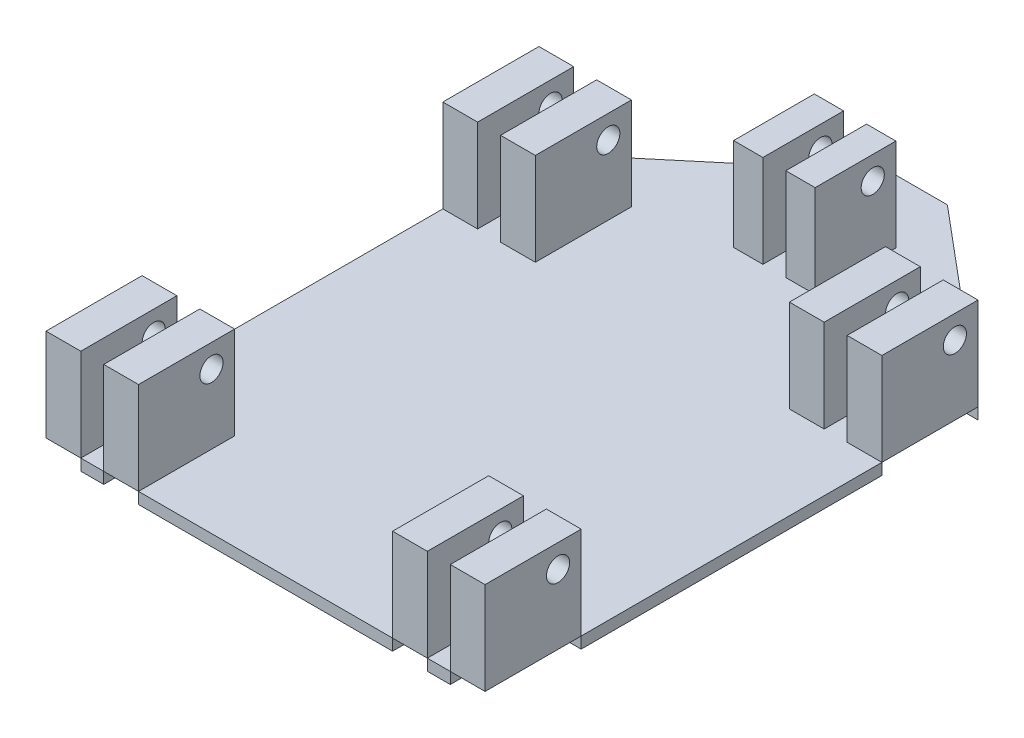
from build123d import *

# Parameters (mm, degrees)
SKETCH3_W              = 12.673843353
SKETCH3_H              = 34.882924186
BOSS_EXTRUDE1_DEPTH    = 40
SKETCH3_W_2            = 15.035841509
SKETCH3_H_2            = 41.527562264
BOSS_EXTRUDE1_2_DEPTH  = 40
SKETCH3_W_3            = 15.03584151
BOSS_EXTRUDE1_3_DEPTH  = 40
BOSS_EXTRUDE1_4_DEPTH  = 40
BOSS_EXTRUDE1_5_DEPTH  = 40
BOSS_EXTRUDE1_6_DEPTH  = 40
BOSS_EXTRUDE1_7_DEPTH  = 40
BOSS_EXTRUDE1_8_DEPTH  = 40
BOSS_EXTRUDE1_9_DEPTH  = 40
BOSS_EXTRUDE1_10_DEPTH = 40
BOSS_EXTRUDE3_DEPTH    = 4.92
CUT_EXTRUDE1_START     = -189.738
SKETCH6_R              = 5
CUT_EXTRUDE1_DEPTH     = 189.738
SKETCH5_R              = 5
CUT_EXTRUDE2_DEPTH     = 203.294
SKETCH4_R              = 5
CUT_EXTRUDE3_DEPTH     = 203.294


with BuildPart() as part:
    # Sketch3 → Boss-Extrude1 (new body)
    with BuildSketch(Plane(origin=(0, 0, 0), x_dir=(1, 0, 0), z_dir=(0, 1, 0))):
        with Locations((-11.289921677, 130.817819602)):
            Rectangle(SKETCH3_W, SKETCH3_H)
    extrude(amount=BOSS_EXTRUDE1_DEPTH)


with BuildPart() as body_2:
    # Sketch3 → Boss-Extrude1 2 (new body)
    with BuildSketch(Plane(origin=(0, 0, 0), x_dir=(1, 0, 0), z_dir=(0, 1, 0))):
        with Locations((-87.351079246, 85.740096226)):
            Rectangle(SKETCH3_W_2, SKETCH3_H_2)
    extrude(amount=BOSS_EXTRUDE1_2_DEPTH)


with BuildPart() as body_3:
    # Sketch3 → Boss-Extrude1 3 (new body)
    with BuildSketch(Plane(origin=(0, 0, 0), x_dir=(1, 0, 0), z_dir=(0, 1, 0))):
        with Locations((-62.409237736, 85.740096226)):
            Rectangle(SKETCH3_W_3, SKETCH3_H_2)
    extrude(amount=BOSS_EXTRUDE1_3_DEPTH)


with BuildPart() as body_4:
    # Sketch3 → Boss-Extrude1 4 (new body)
    with BuildSketch(Plane(origin=(0, 0, 0), x_dir=(1, 0, 0), z_dir=(0, 1, 0))):
        with Locations((62.409237736, 85.740096226)):
            Rectangle(SKETCH3_W_3, SKETCH3_H_2)
    extrude(amount=BOSS_EXTRUDE1_4_DEPTH)


with BuildPart() as body_5:
    # Sketch3 → Boss-Extrude1 5 (new body)
    with BuildSketch(Plane(origin=(0, 0, 0), x_dir=(1, 0, 0), z_dir=(0, 1, 0))):
        with Locations((87.351079246, 85.740096226)):
            Rectangle(SKETCH3_W_2, SKETCH3_H_2)
    extrude(amount=BOSS_EXTRUDE1_5_DEPTH)


with BuildPart() as body_6:
    # Sketch3 → Boss-Extrude1 6 (new body)
    with BuildSketch(Plane(origin=(0, 0, 0), x_dir=(1, 0, 0), z_dir=(0, 1, 0))):
        with Locations((-87.351079246, -85.740096226)):
            Rectangle(SKETCH3_W_2, SKETCH3_H_2)
    extrude(amount=BOSS_EXTRUDE1_6_DEPTH)


with BuildPart() as body_7:
    # Sketch3 → Boss-Extrude1 7 (new body)
    with BuildSketch(Plane(origin=(0, 0, 0), x_dir=(1, 0, 0), z_dir=(0, 1, 0))):
        with Locations((-62.409237736, -85.740096226)):
            Rectangle(SKETCH3_W_3, SKETCH3_H_2)
    extrude(amount=BOSS_EXTRUDE1_7_DEPTH)


with BuildPart() as body_8:
    # Sketch3 → Boss-Extrude1 8 (new body)
    with BuildSketch(Plane(origin=(0, 0, 0), x_dir=(1, 0, 0), z_dir=(0, 1, 0))):
        with Locations((62.409237736, -85.740096226)):
            Rectangle(SKETCH3_W_3, SKETCH3_H_2)
    extrude(amount=BOSS_EXTRUDE1_8_DEPTH)


with BuildPart() as body_9:
    # Sketch3 → Boss-Extrude1 9 (new body)
    with BuildSketch(Plane(origin=(0, 0, 0), x_dir=(1, 0, 0), z_dir=(0, 1, 0))):
        with Locations((87.351079246, -85.740096226)):
            Rectangle(SKETCH3_W_2, SKETCH3_H_2)
    extrude(amount=BOSS_EXTRUDE1_9_DEPTH)


with BuildPart() as body_10:
    # Sketch3 → Boss-Extrude1 10 (new body)
    with BuildSketch(Plane(origin=(0, 0, 0), x_dir=(1, 0, 0), z_dir=(0, 1, 0))):
        with Locations((11.289921677, 130.817819602)):
            Rectangle(SKETCH3_W, SKETCH3_H)
    extrude(amount=BOSS_EXTRUDE1_10_DEPTH)


with BuildPart() as body_11:
    # Sketch3<5> → Boss-Extrude3 (new body)
    with BuildSketch(Plane(origin=(0, 0, 0), x_dir=(1, 0, 0), z_dir=(0, 1, 0))):
        Polygon((74.880158491, -106.503877358), (79.833158491, -106.503877358), (79.833158491, -64.976315094), (94.869, -64.976315094), (94.869, 64.976315094), (79.833158491, 64.976315094), (79.833158491, 106.503877358), (69.927158491, 106.503877358), (69.927158491, 64.976315094), (54.891316981, 64.976315094), (54.891316981, 106.503877358), (-54.891316981, 106.503877358), (-54.891316981, 64.976315094), (-69.927158491, 64.976315094), (-69.927158491, 106.503877358), (-79.833158491, 106.503877358), (-79.833158491, 64.976315094), (-94.869, 64.976315094), (-94.869, -64.976315094), (-79.833158491, -64.976315094), (-79.833158491, -106.503877358), (-74.880158491, -106.503877358), (-69.927158491, -106.503877358), (-69.927158491, -64.976315094), (-54.891316981, -64.976315094), (-54.891316981, -106.503877358), (54.891316981, -106.503877358), (54.891316981, -64.976315094), (69.927158491, -64.976315094), (69.927158491, -106.503877358), align=None)
        Polygon((79.833158491, 106.503877358), (94.869, 106.503877358), (45.106846872, 148.259281695), (17.626843353, 148.259281695), (17.626843353, 113.376357509), (4.953, 113.376357509), (4.953, 148.259281695), (-4.953, 148.259281695), (-4.953, 113.376357509), (-17.626843353, 113.376357509), (-17.626843353, 148.259281695), (-45.106846872, 148.259281695), (-94.869, 106.503877358), (-79.833158491, 106.503877358), (-69.927158491, 106.503877358), (-54.891316981, 106.503877358), (54.891316981, 106.503877358), (69.927158491, 106.503877358), align=None)
        Polygon((17.626843353, 148.259281695), (45.106846872, 148.259281695), (12.635755252, 175.505762697), (-12.635755252, 175.505762697), (-45.106846872, 148.259281695), (-17.626843353, 148.259281695), (-4.953, 148.259281695), (4.953, 148.259281695), align=None)
    extrude(amount=-BOSS_EXTRUDE3_DEPTH)


with BuildPart() as cut_extrude1_tool:
    # Sketch6 → Cut-Extrude1 (new body)
    with BuildSketch(Plane.ZY.offset(94.869).offset(CUT_EXTRUDE1_START)):
        with Locations((74.976315094, 30)):
            Circle(SKETCH6_R)
    extrude(amount=CUT_EXTRUDE1_DEPTH)


with BuildPart() as body_6_1:
    add(body_6.part)

    # Cut-Extrude1: cut by cut_extrude1_tool
    add(cut_extrude1_tool.part, mode=Mode.SUBTRACT)


with BuildPart() as body_7_1:
    add(body_7.part)

    # Cut-Extrude1: cut by cut_extrude1_tool
    add(cut_extrude1_tool.part, mode=Mode.SUBTRACT)


with BuildPart() as body_8_1:
    add(body_8.part)

    # Cut-Extrude1: cut by cut_extrude1_tool
    add(cut_extrude1_tool.part, mode=Mode.SUBTRACT)


with BuildPart() as body_9_1:
    add(body_9.part)

    # Cut-Extrude1: cut by cut_extrude1_tool
    add(cut_extrude1_tool.part, mode=Mode.SUBTRACT)


with BuildPart() as cut_extrude2_tool:
    # Sketch5 → Cut-Extrude2 (new body)
    with BuildSketch(Plane.ZY.offset(17.626843353)):
        with Locations(Location((-138.259281695, 30, 0), (0, 0, 180))):
            Circle(SKETCH5_R)
    extrude(amount=-CUT_EXTRUDE2_DEPTH)


with BuildPart() as part_1:
    add(part.part)

    # Cut-Extrude2: cut by cut_extrude2_tool
    add(cut_extrude2_tool.part, mode=Mode.SUBTRACT)


with BuildPart() as body_10_1:
    add(body_10.part)

    # Cut-Extrude2: cut by cut_extrude2_tool
    add(cut_extrude2_tool.part, mode=Mode.SUBTRACT)


with BuildPart() as cut_extrude3_tool:
    # Sketch4 → Cut-Extrude3 (new body)
    with BuildSketch(Plane.ZY.offset(94.869)):
        with Locations((-96.503877358, 30)):
            Circle(SKETCH4_R)
    extrude(amount=-CUT_EXTRUDE3_DEPTH)


with BuildPart() as body_2_1:
    add(body_2.part)

    # Cut-Extrude3: cut by cut_extrude3_tool
    add(cut_extrude3_tool.part, mode=Mode.SUBTRACT)


with BuildPart() as body_3_1:
    add(body_3.part)

    # Cut-Extrude3: cut by cut_extrude3_tool
    add(cut_extrude3_tool.part, mode=Mode.SUBTRACT)


with BuildPart() as body_4_1:
    add(body_4.part)

    # Cut-Extrude3: cut by cut_extrude3_tool
    add(cut_extrude3_tool.part, mode=Mode.SUBTRACT)


with BuildPart() as body_5_1:
    add(body_5.part)

    # Cut-Extrude3: cut by cut_extrude3_tool
    add(cut_extrude3_tool.part, mode=Mode.SUBTRACT)


solid = Compound([body_11.part, body_6_1.part, body_7_1.part, body_8_1.part, body_9_1.part, part_1.part, body_10_1.part, body_2_1.part, body_3_1.part, body_4_1.part, body_5_1.part])
